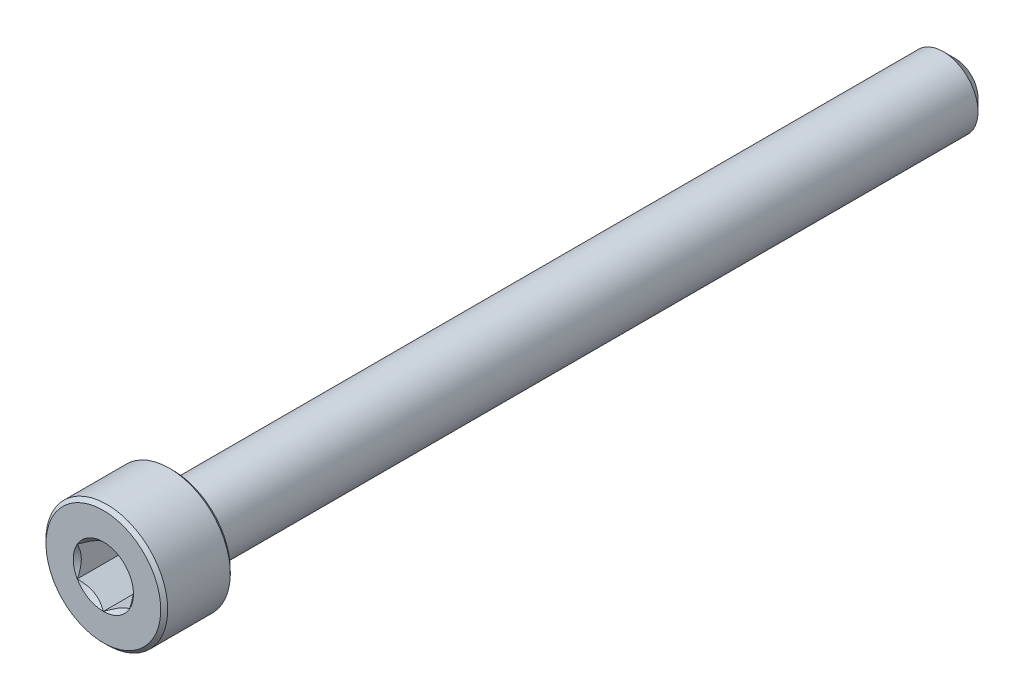
from build123d import *

# Parameters (mm, degrees)
CUT_EXTRUDE1_DEPTH = 3


with BuildPart() as part:
    # Sketch2 → Revolve1 (revolve)
    with BuildSketch(Plane(origin=(0, 0, 0), x_dir=(0, 0, -1), z_dir=(1, 0, 0))):
        Polygon((-24.5, 0), (-24.5, 3.3), (-24.3, 3.5), (-20.7, 3.5), (-20.5, 3.3), (-20.5, 2), (23.8, 2), (24.5, 1.3), (24.5, 0), align=None)
    revolve(axis=Axis((0, 0, -24.5), (0, 0, 1)))

    # Sketch3 → Cut-Extrude1 (cut)
    with BuildSketch(Plane.XY.offset(24.5)):
        Polygon((1.5, -0.866025404), (1.5, 0.866025404), (0, 1.732050808), (-1.5, 0.866025404), (-1.5, -0.866025404), (0, -1.732050808), align=None)
    extrude(amount=-CUT_EXTRUDE1_DEPTH, mode=Mode.SUBTRACT)

    # Cut-Extrude2 cone 1 section (through the dimple's axis) → Cut-Extrude2 (revolve, cut)
    with BuildSketch(Plane(origin=(0, 0, 24.5), x_dir=(0, -1, 0), z_dir=(1, 0, 0))):
        Polygon((0, 0), (1.732050808, 0), (0, 1.732050808), align=None)
    revolve(axis=Axis((0, 0, 24.5), (0, 0, -1)), mode=Mode.SUBTRACT)


solid = part.part
